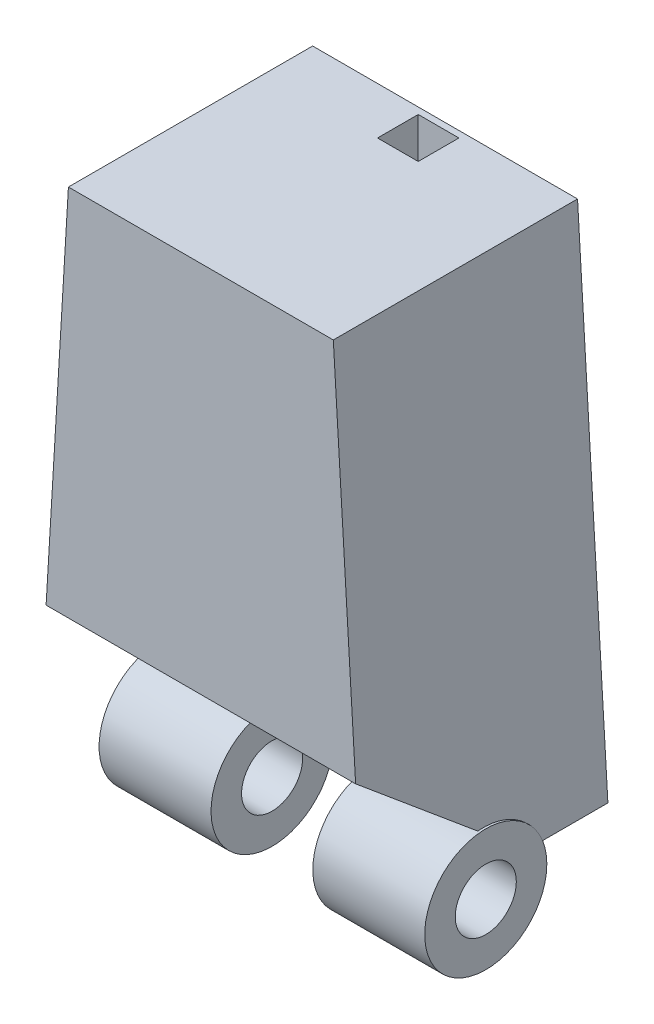
from build123d import *

# Parameters (mm, degrees)
BOSS_EXTRUDE1_DEPTH     = 12
CUT_EXTRUDE1_DEPTH      = 35.611065794
CUT_EXTRUDE1_DEPTH_BACK = 35.611065794
SKETCH6_R               = 3
SKETCH6_R_2             = 1.5
BOSS_EXTRUDE2_DEPTH     = 8
SKETCH6_3_R             = 3
SKETCH6_3_R_2           = 1.5
CUT_EXTRUDE2_DEPTH      = 2.5
CUT_EXTRUDE3_DEPTH      = 5
SKETCH8_R               = 1.5
BOSS_EXTRUDE3_DEPTH     = 5.5
CUT_EXTRUDE4_DEPTH      = 35.611065794
CUT_EXTRUDE4_DEPTH_BACK = 35.611065794
SKETCH9_W               = 12
SKETCH9_H               = 6.507668331
CUT_EXTRUDE5_DEPTH      = 1


with BuildPart() as part:
    # Sketch1 → Boss-Extrude1 (new body)
    with BuildSketch(Plane.XY):
        with BuildLine():
            Line((-56.5742778, 0), (-40.5742778, 0))
            Line((-40.5742778, 0), (-42.066609469, 24.955419175))
            ThreePointArc((-42.066609469, 24.955419175), (-48.5742778, 31.463087506), (-55.081946131, 24.955419175))
            Line((-55.081946131, 24.955419175), (-56.5742778, 0))
        make_face()
    extrude(amount=BOSS_EXTRUDE1_DEPTH)

    # Sketch3 → Cut-Extrude1 (cut, two sides: drawn at the far end of the back side and taken through both)
    with BuildSketch(Plane(origin=(-48.5742778, 0, 0), x_dir=(0, 0, -1), z_dir=(1, 0, 0)).offset(-CUT_EXTRUDE1_DEPTH_BACK)):
        Polygon((-12, 0), (-4, 0), (-12, 6.613954944), align=None)
    extrude(amount=CUT_EXTRUDE1_DEPTH + CUT_EXTRUDE1_DEPTH_BACK, mode=Mode.SUBTRACT)

    # Sketch6 → Boss-Extrude2 (add, symmetric)
    with BuildSketch(Plane(origin=(-48.5742778, 0, 0), x_dir=(0, 0, -1), z_dir=(1, 0, 0))):
        with Locations((-6, -1.1)):
            Circle(SKETCH6_R)
        with Locations((-6, -1.1)):
            Circle(SKETCH6_R_2, mode=Mode.SUBTRACT)
    extrude(amount=BOSS_EXTRUDE2_DEPTH, both=True)

    # Sketch6<3> → Cut-Extrude2 (cut, symmetric)
    with BuildSketch(Plane(origin=(-48.5742778, 0, 0), x_dir=(0, 0, -1), z_dir=(1, 0, 0))):
        with Locations((-6, -1.1)):
            Circle(SKETCH6_3_R)
        with Locations((-6, -1.1)):
            Circle(SKETCH6_3_R_2, mode=Mode.SUBTRACT)
    extrude(amount=CUT_EXTRUDE2_DEPTH, both=True, mode=Mode.SUBTRACT)

    # Sketch7 → Cut-Extrude3 (cut, symmetric)
    with BuildSketch(Plane(origin=(-48.5742778, 0, 0), x_dir=(0, 0, -1), z_dir=(1, 0, 0))):
        Polygon((-7.161655697, 2.613881041), (-11.015220244, 5.799793827), (-7.829307458, 9.653358374), (-3.975742911, 6.467445588), align=None)
    extrude(amount=CUT_EXTRUDE3_DEPTH, both=True, mode=Mode.SUBTRACT)

    # Sketch8 → Boss-Extrude3 (add, symmetric)
    with BuildSketch(Plane(origin=(-48.5742778, 0, 0), x_dir=(0, 0, -1), z_dir=(1, 0, 0))):
        with Locations((-7.548090256, 6.177113636)):
            Circle(SKETCH8_R)
    extrude(amount=BOSS_EXTRUDE3_DEPTH, both=True)

    # Sketch9 → Cut-Extrude4 (cut, two sides: drawn at the far end of the back side and taken through both)
    with BuildSketch(Plane(origin=(-48.5742778, 0, 0), x_dir=(0, 0, -1), z_dir=(1, 0, 0)).offset(-CUT_EXTRUDE4_DEPTH_BACK)):
        with Locations((-6, 28.209253341)):
            Rectangle(SKETCH9_W, SKETCH9_H)
    extrude(amount=CUT_EXTRUDE4_DEPTH + CUT_EXTRUDE4_DEPTH_BACK, mode=Mode.SUBTRACT)

    # Sketch10 → Cut-Extrude5 (cut, symmetric)
    with BuildSketch(Plane(origin=(-48.5742778, 0, 0), x_dir=(0, 0, -1), z_dir=(1, 0, 0))):
        Polygon((-2.32, 0), (-0.32, 0), (-0.32, 0.801486087), (-0.32, 27.377264347), (-2.32, 27.377264347), (-2.32, 0.801486087), align=None)
    extrude(amount=CUT_EXTRUDE5_DEPTH, both=True, mode=Mode.SUBTRACT)


solid = part.part
